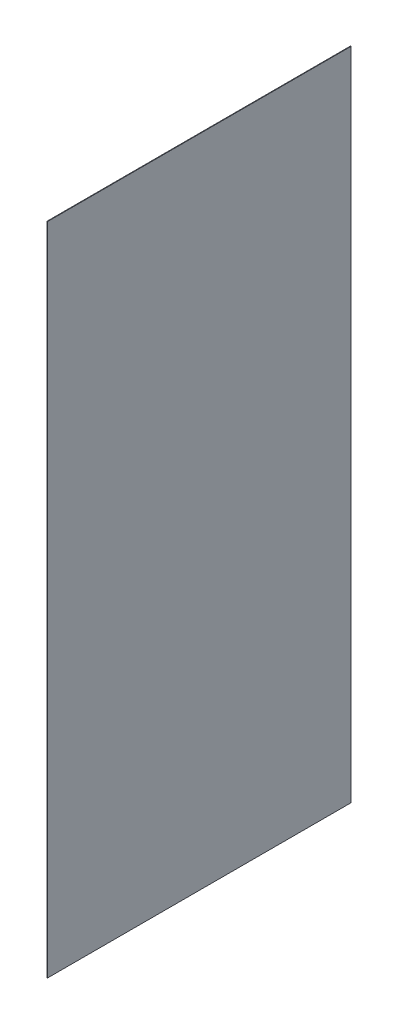
from build123d import *

# Parameters (mm, degrees)
SKETCH1_W                   = 1.5
SKETCH1_H                   = 1770
TOPPING_DIS_YAN_SAG_1_DEPTH = 820


with BuildPart() as part:
    # Sketch1 → TOPPING_dis_yan_sag_1 (new body)
    with BuildSketch(Plane.XY):
        with Locations((699.25, 1085)):
            Rectangle(SKETCH1_W, SKETCH1_H)
    extrude(amount=-TOPPING_DIS_YAN_SAG_1_DEPTH)


solid = part.part
